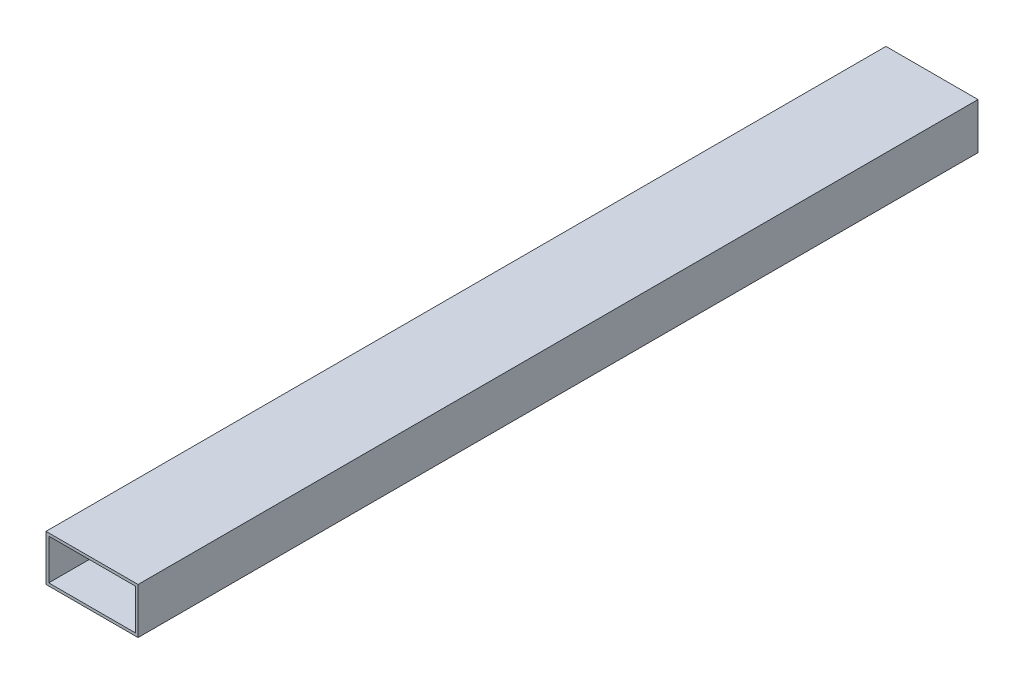
from build123d import *

# Parameters (mm, degrees)
SKETCH1_W           = 50.8
SKETCH1_H           = 25.4
SKETCH1_W_2         = 47.752
SKETCH1_H_2         = 22.352
EXTRUDE_THIN1_DEPTH = 463.55


with BuildPart() as part:
    # Sketch1 → Extrude-Thin1 (new body)
    with BuildSketch(Plane.XY):
        with Locations((-25.4, 12.7)):
            Rectangle(SKETCH1_W, SKETCH1_H)
        with Locations((-25.4, 12.7)):
            Rectangle(SKETCH1_W_2, SKETCH1_H_2, mode=Mode.SUBTRACT)
    extrude(amount=EXTRUDE_THIN1_DEPTH)


solid = part.part
